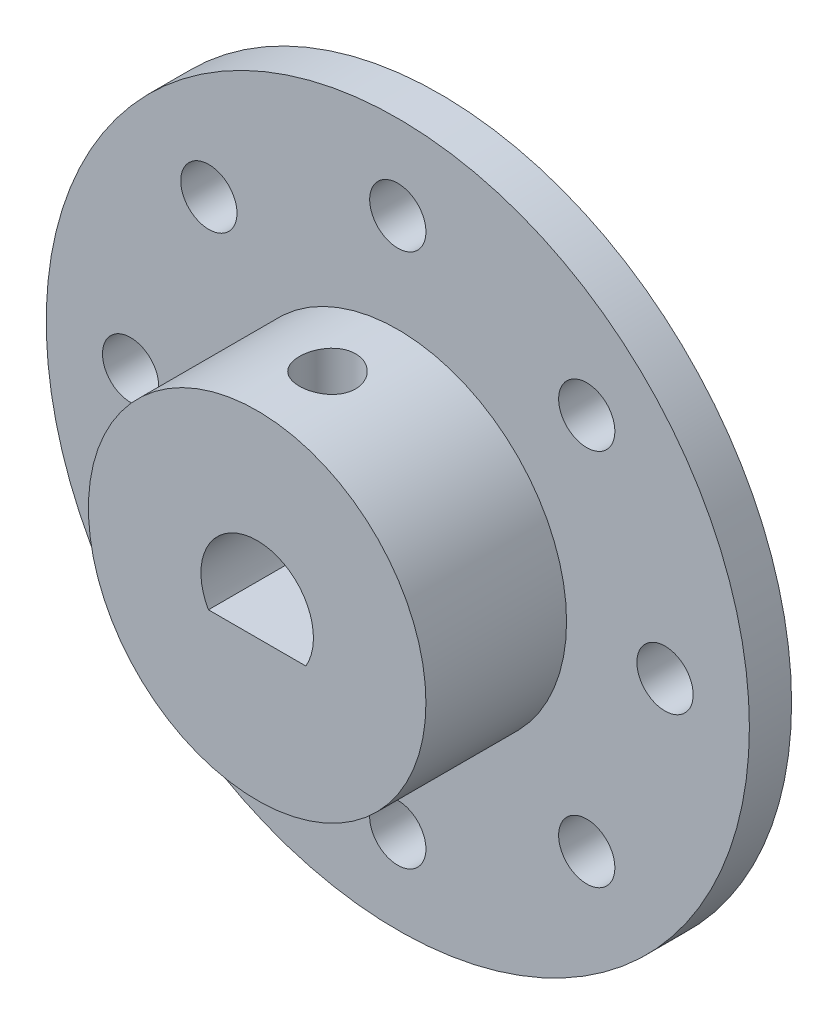
from build123d import *

# Parameters (mm, degrees)
SKETCH_1_R          = 25
SKETCH_1_R_2        = 2
SKETCH_1_R_3        = 4
EXTRUDE_1_DEPTH     = 3
SKETCH_2_R          = 12
EXTRUDE_2_DEPTH     = 10
CUT_EXTRUDE_START   = -24
CUT_EXTRUDE_1_DEPTH = 24
SKETCH_4_R          = 2
CUT_EXTRUDE_2_DEPTH = 19


with BuildPart() as part:
    # 草图1 → 凸台-拉伸1 (new body)
    with BuildSketch(Plane.XY):
        Circle(SKETCH_1_R)
        with Locations((0, 19)):
            Circle(SKETCH_1_R_2, mode=Mode.SUBTRACT)
        with Locations((13.435028843, 13.435028843)):
            Circle(SKETCH_1_R_2, mode=Mode.SUBTRACT)
        with Locations((19, 0)):
            Circle(SKETCH_1_R_2, mode=Mode.SUBTRACT)
        with Locations((13.435028843, -13.435028843)):
            Circle(SKETCH_1_R_2, mode=Mode.SUBTRACT)
        with Locations((0, -19)):
            Circle(SKETCH_1_R_2, mode=Mode.SUBTRACT)
        with Locations((-13.435028843, -13.435028843)):
            Circle(SKETCH_1_R_2, mode=Mode.SUBTRACT)
        with Locations((-19, 0)):
            Circle(SKETCH_1_R_2, mode=Mode.SUBTRACT)
        with Locations((-13.435028843, 13.435028843)):
            Circle(SKETCH_1_R_2, mode=Mode.SUBTRACT)
        Circle(SKETCH_1_R_3, mode=Mode.SUBTRACT)
    extrude(amount=EXTRUDE_1_DEPTH)

    # 草图2 → 凸台-拉伸2 (add)
    with BuildSketch(Plane.XY.offset(3)):
        Circle(SKETCH_2_R)
    extrude(amount=EXTRUDE_2_DEPTH)

    # 草图3 → 切除-拉伸1 (cut)
    with BuildSketch(Plane.XY.offset(13).offset(CUT_EXTRUDE_START)):
        with BuildLine():
            Line((-3.464101615, -2), (3.464101615, -2))
            ThreePointArc((3.464101615, -2), (0, 4), (-3.464101615, -2))
        make_face()
    extrude(amount=CUT_EXTRUDE_1_DEPTH, mode=Mode.SUBTRACT)

    # 草图4 → 切除-拉伸2 (cut)
    with BuildSketch(Plane(origin=(0, -2, 0), x_dir=(1, 0, 0), z_dir=(0, 1, 0))):
        with Locations(Location((0, -8, 0), (0, 0, 90))):
            Circle(SKETCH_4_R)
    extrude(amount=CUT_EXTRUDE_2_DEPTH, mode=Mode.SUBTRACT)


solid = part.part
